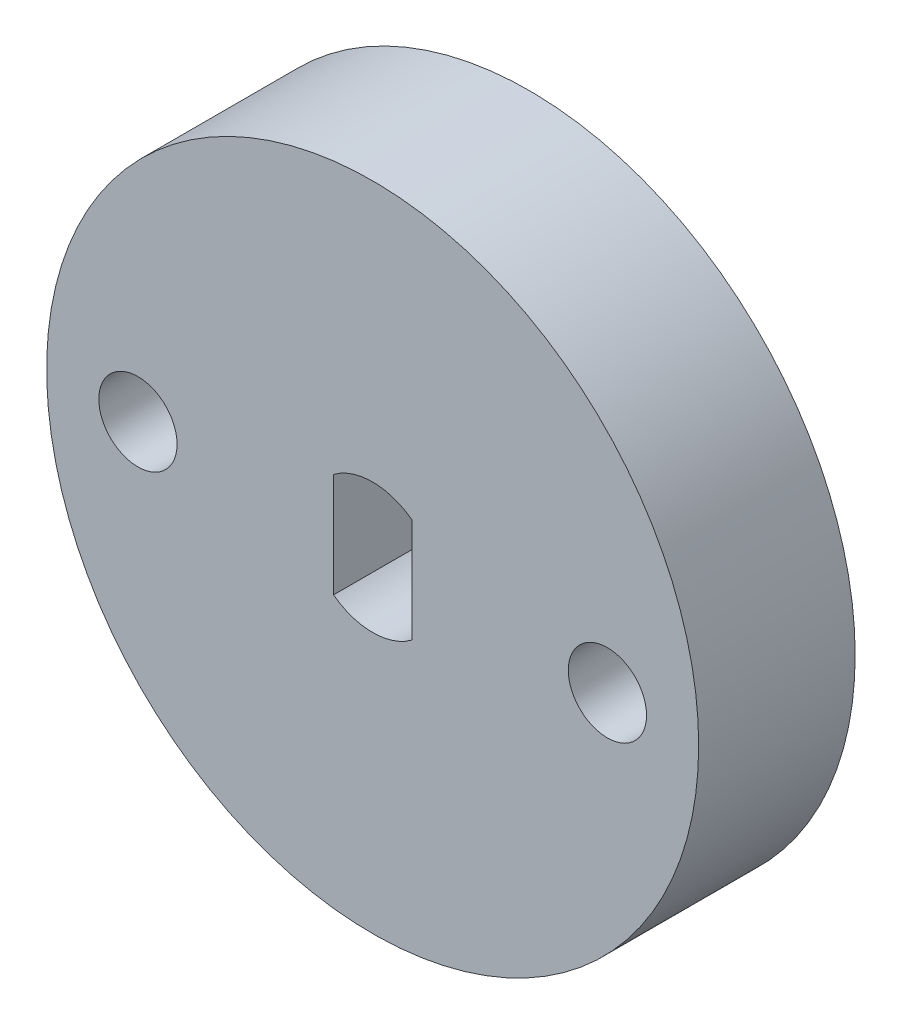
from build123d import *

# Parameters (mm, degrees)
SKETCH1_R           = 12.5
BOSS_EXTRUDE1_DEPTH = 3
SKETCH2_R           = 1.5
CUT_EXTRUDE1_DEPTH  = 19.668154703


with BuildPart() as part:
    # Sketch1 → Boss-Extrude1 (new, symmetric)
    with BuildSketch(Plane.XY):
        Circle(SKETCH1_R)
    extrude(amount=BOSS_EXTRUDE1_DEPTH, both=True)

    # Sketch2 → Cut-Extrude1 (cut, through all)
    with BuildSketch(Plane.XY.offset(3)):
        with Locations((-9, 0)):
            Circle(SKETCH2_R)
        with Locations((9, 0)):
            Circle(SKETCH2_R)
        with BuildLine():
            Line((1.5, -2), (1.5, 2))
            ThreePointArc((1.5, 2), (0, 2.5), (-1.5, 2))
            Line((-1.5, 2), (-1.5, -2))
            ThreePointArc((-1.5, -2), (0, -2.5), (1.5, -2))
        make_face()
    extrude(amount=-CUT_EXTRUDE1_DEPTH, mode=Mode.SUBTRACT)


solid = part.part
